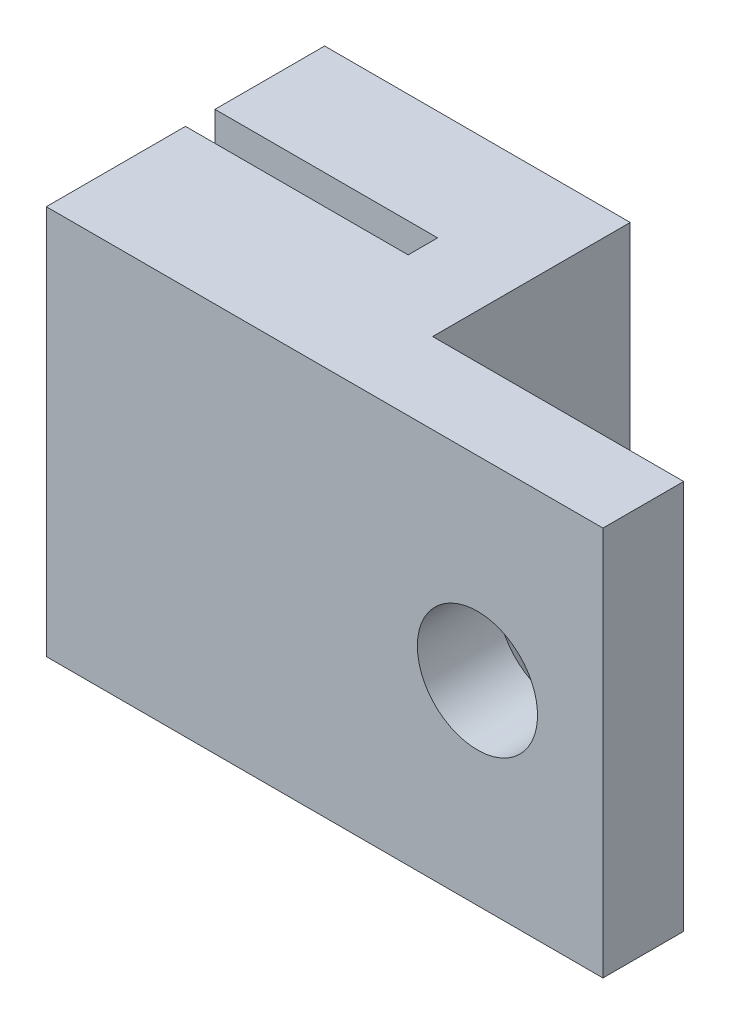
from build123d import *

# Parameters (mm, degrees)
BOSS_EXTRUDE1_DEPTH = 14
SKETCH2_W           = 9.019698715
SKETCH2_H           = 7.099583751
CUT_EXTRUDE1_DEPTH  = 1301.121764584
SKETCH4_R           = 2.159
CUT_EXTRUDE2_DEPTH  = 1238.809657762


with BuildPart() as part:
    # Sketch1 → Boss-Extrude1 (new body)
    with BuildSketch(Plane(origin=(0, 0, 0), x_dir=(1, 0, 0), z_dir=(0, 1, 0))):
        Polygon((-1237.710121457, -392.736417727), (-1237.710121457, -397.736417727), (-1217.710121457, -397.736417727), (-1217.710121457, -387.736417727), (-1237.710121457, -387.736417727), (-1237.710121457, -391.676417727), (-1229.710121457, -391.676417727), (-1229.710121457, -392.736417727), align=None)
    extrude(amount=-BOSS_EXTRUDE1_DEPTH)

    # Sketch2 → Cut-Extrude1 (cut, through all)
    with BuildSketch(Plane(origin=(0, 0, 0), x_dir=(1, 0, 0), z_dir=(0, 1, 0))):
        with Locations((-1222.219970814, -391.286209602)):
            Rectangle(SKETCH2_W, SKETCH2_H)
    extrude(amount=-CUT_EXTRUDE1_DEPTH, mode=Mode.SUBTRACT)

    # Sketch4 → Cut-Extrude2 (cut, through all)
    with BuildSketch(Plane(origin=(0, 0, 394.836001478), x_dir=(-1, 0, 0), z_dir=(0, 0, -1))):
        with Locations((1222.219970815, -7)):
            Circle(SKETCH4_R)
    extrude(amount=-CUT_EXTRUDE2_DEPTH, mode=Mode.SUBTRACT)


solid = part.part
